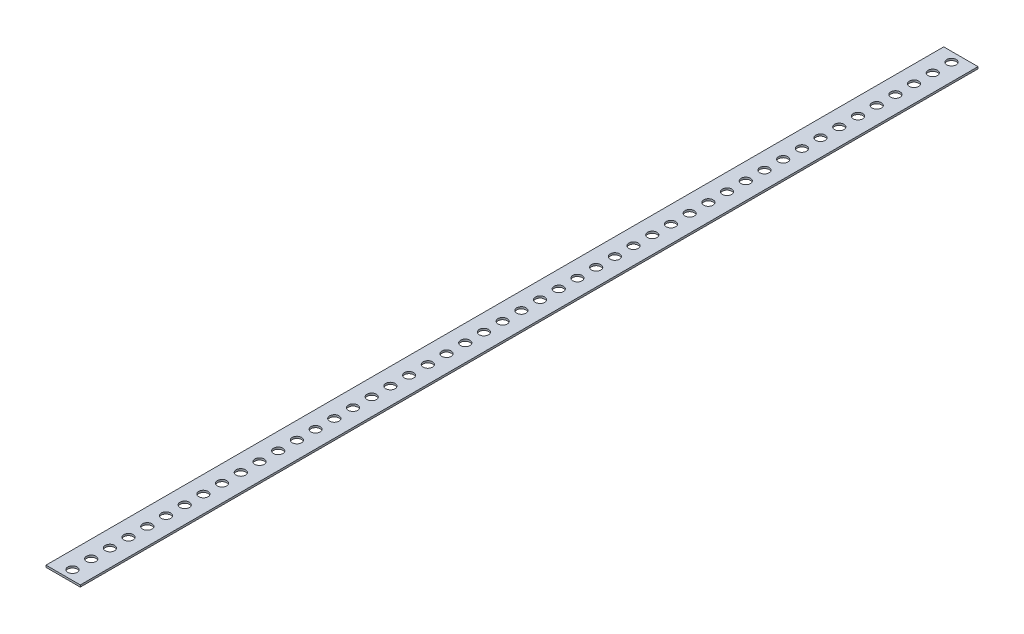
from build123d import *

# Parameters (mm, degrees)
BOSS_EXTRUDE1_DEPTH      = 0.99187
BOSS_EXTRUDE1_DEPTH_BACK = 0.99187
SKETCH3_W                = 34.925
SKETCH3_H                = 914.4
CUT_EXTRUDE1_REACH       = 459.538
SKETCH4_R                = 4.7625
LPATTERN1_COUNT          = 53
LPATTERN1_PITCH          = 19.05


with BuildPart() as part:
    # Sketch3 → Boss-Extrude1 (new, two sides: drawn at the far end of the back side and taken through both)
    with BuildSketch(Plane(origin=(0, 0, 0), x_dir=(1, 0, 0), z_dir=(0, 1, 0)).offset(-BOSS_EXTRUDE1_DEPTH_BACK)):
        Rectangle(SKETCH3_W, SKETCH3_H)
    extrude(amount=BOSS_EXTRUDE1_DEPTH + BOSS_EXTRUDE1_DEPTH_BACK)

    # Sketch4 → Cut-Extrude1 (cut, up to next)
    with BuildSketch(Plane(origin=(0, 0.99187, 0), x_dir=(1, 0, 0), z_dir=(0, 1, 0)), mode=Mode.PRIVATE) as cut_extrude1_sk1:
        with Locations(Location((0, -447.675, 0), (0, 0, 270))):
            Circle(SKETCH4_R)
    cut_extrude1_tool1 = extrude(cut_extrude1_sk1.sketch, amount=-CUT_EXTRUDE1_REACH, mode=Mode.PRIVATE) & part.part
    cut_extrude1 = cut_extrude1_tool1.solids().sort_by_distance((0, 0.99187, 447.675))[0]
    add(cut_extrude1, mode=Mode.SUBTRACT)

    # LPattern1: Cut-Extrude1 ×53
    with Locations(*[(0, 0, -i * LPATTERN1_PITCH) for i in range(1, LPATTERN1_COUNT)]):
        add(cut_extrude1, mode=Mode.SUBTRACT)


solid = part.part
